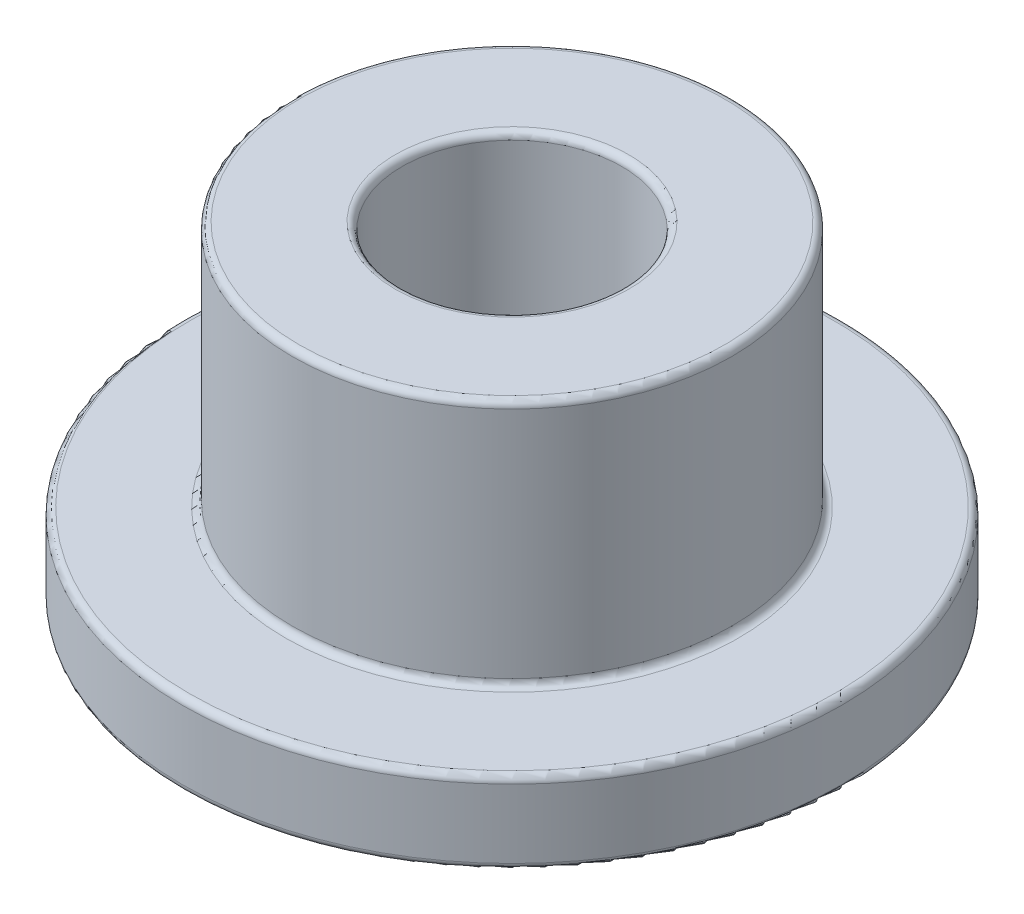
from build123d import *

# Parameters (mm, degrees)
SKETCH3_R           = 4
SKETCH3_R_2         = 2
BOSS_EXTRUDE1_DEPTH = 6
SKETCH4_R           = 6
SKETCH4_R_2         = 4
BOSS_EXTRUDE2_DEPTH = 1.5
FILLET1_R           = 0.125


with BuildPart() as part:
    # Sketch3 → Boss-Extrude1 (new body)
    with BuildSketch(Plane(origin=(0, 0, 0), x_dir=(1, 0, 0), z_dir=(0, 1, 0))):
        with Locations(Location((0, 0, 0), (0, 0, 270))):
            Circle(SKETCH3_R)
        with Locations(Location((0, 0, 0), (0, 0, 270))):
            Circle(SKETCH3_R_2, mode=Mode.SUBTRACT)
    extrude(amount=BOSS_EXTRUDE1_DEPTH)

    # Sketch4 → Boss-Extrude2 (add)
    with BuildSketch(Plane(origin=(0, 0, 0), x_dir=(1, 0, 0), z_dir=(0, 1, 0))):
        with Locations(Location((0, 0, 0), (0, 0, 270))):
            Circle(SKETCH4_R)
        with Locations(Location((0, 0, 0), (0, 0, 270))):
            Circle(SKETCH4_R_2, mode=Mode.SUBTRACT)
    extrude(amount=BOSS_EXTRUDE2_DEPTH)

    # Fillet1
    fillet1_edges = [part.edges().sort_by_distance(p)[0] for p in [
        (0, 1.5, -6),
        (0, 0, -6),
        (0, 1.5, -4),
        (0, 6, -4),
        (0, 0, -2),
        (0, 6, -2),
    ]]
    fillet(fillet1_edges, radius=FILLET1_R)


solid = part.part
